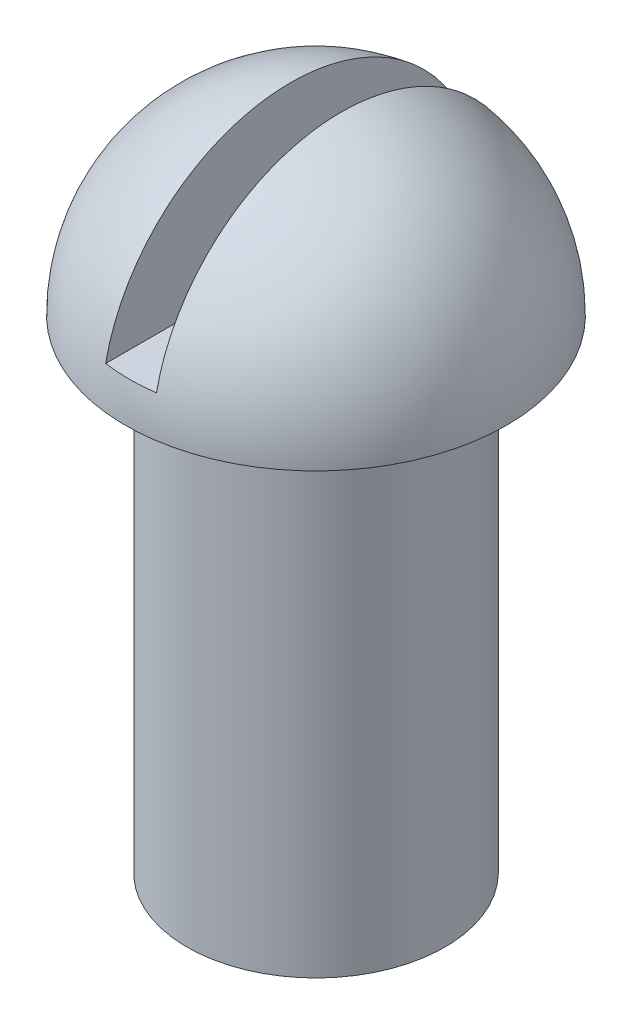
from build123d import *

# Parameters (mm, degrees)
CUT_EXTRUDE1_DEPTH      = 58.08765190476833
CUT_EXTRUDE1_DEPTH_BACK = 58.08765190476833


with BuildPart() as part:
    # Sketch1 → Revolve1 (revolve)
    with BuildSketch(Plane.XY):
        with BuildLine():
            Line((6.09e-15, 52.99999999999999), (0, 0))
            Line((0, 0), (10.15, 2.5e-16))
            Line((10.15, 2.5e-16), (10.149999999999995, 38))
            Line((10.149999999999995, 38), (15.000000000000009, 37.99999999999999))
            ThreePointArc((15.000000000000009, 37.99999999999999), (10.60660171779822, 48.606601717798206), (6.09e-15, 52.99999999999999))
        make_face()
    revolve(axis=Axis((6.09e-15, 52.99999999999999, 0), (-1.1e-16, -1, 0)))

    # Sketch2 → Cut-Extrude1 (cut, two sides: drawn at the far end of the back side and taken through both)
    with BuildSketch(Plane.XY.offset(-CUT_EXTRUDE1_DEPTH_BACK)):
        with BuildLine():
            Line((-2, 41), (2, 41))
            Line((2, 41), (2, 52.8660687473185))
            ThreePointArc((2, 52.8660687473185), (-4e-16, 52.99999999999999), (-2, 52.8660687473185))
            Line((-2, 52.8660687473185), (-2, 41))
        make_face()
    extrude(amount=CUT_EXTRUDE1_DEPTH + CUT_EXTRUDE1_DEPTH_BACK, mode=Mode.SUBTRACT)


solid = part.part
